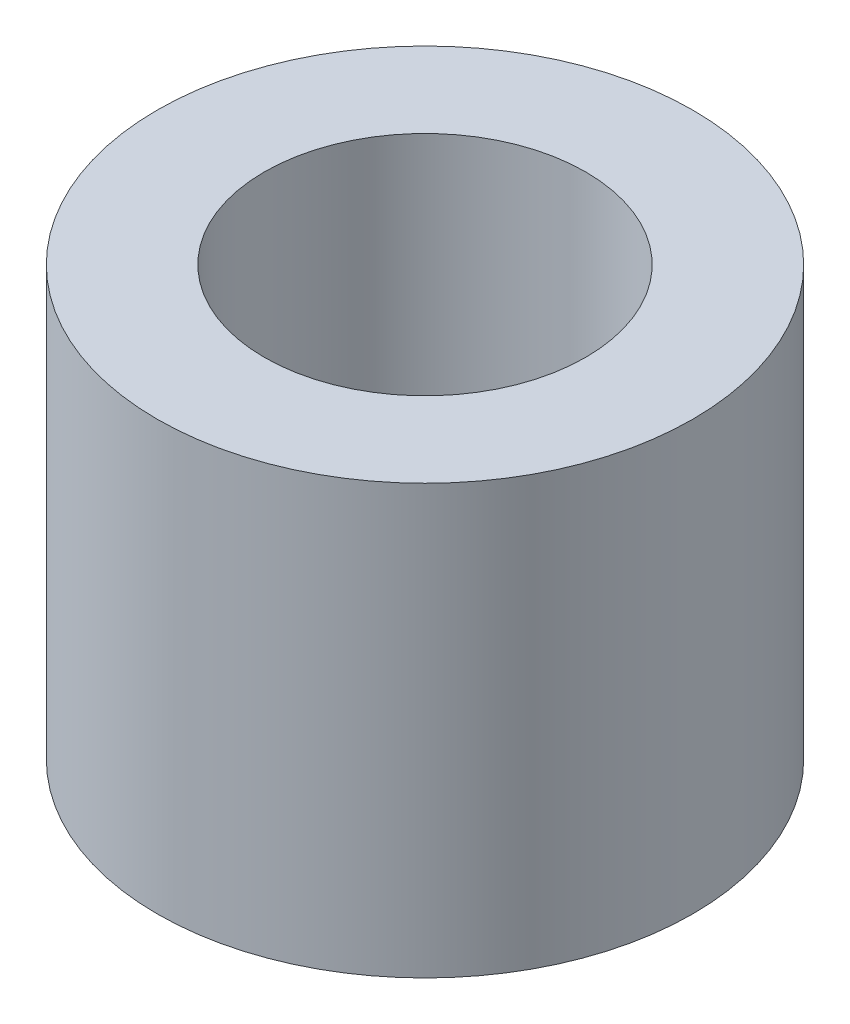
from build123d import *

# Parameters (mm, degrees)
SKETCH1_R           = 2.5
SKETCH1_R_2         = 1.5
BOSS_EXTRUDE1_DEPTH = 4


with BuildPart() as part:
    # Sketch1 → Boss-Extrude1 (new body)
    with BuildSketch(Plane(origin=(0, 0, 0), x_dir=(1, 0, 0), z_dir=(0, 1, 0))):
        with Locations(Location((0, 0, 0), (0, 0, 270))):
            Circle(SKETCH1_R)
        with Locations(Location((0, 0, 0), (0, 0, 270))):
            Circle(SKETCH1_R_2, mode=Mode.SUBTRACT)
    extrude(amount=BOSS_EXTRUDE1_DEPTH)


solid = part.part
